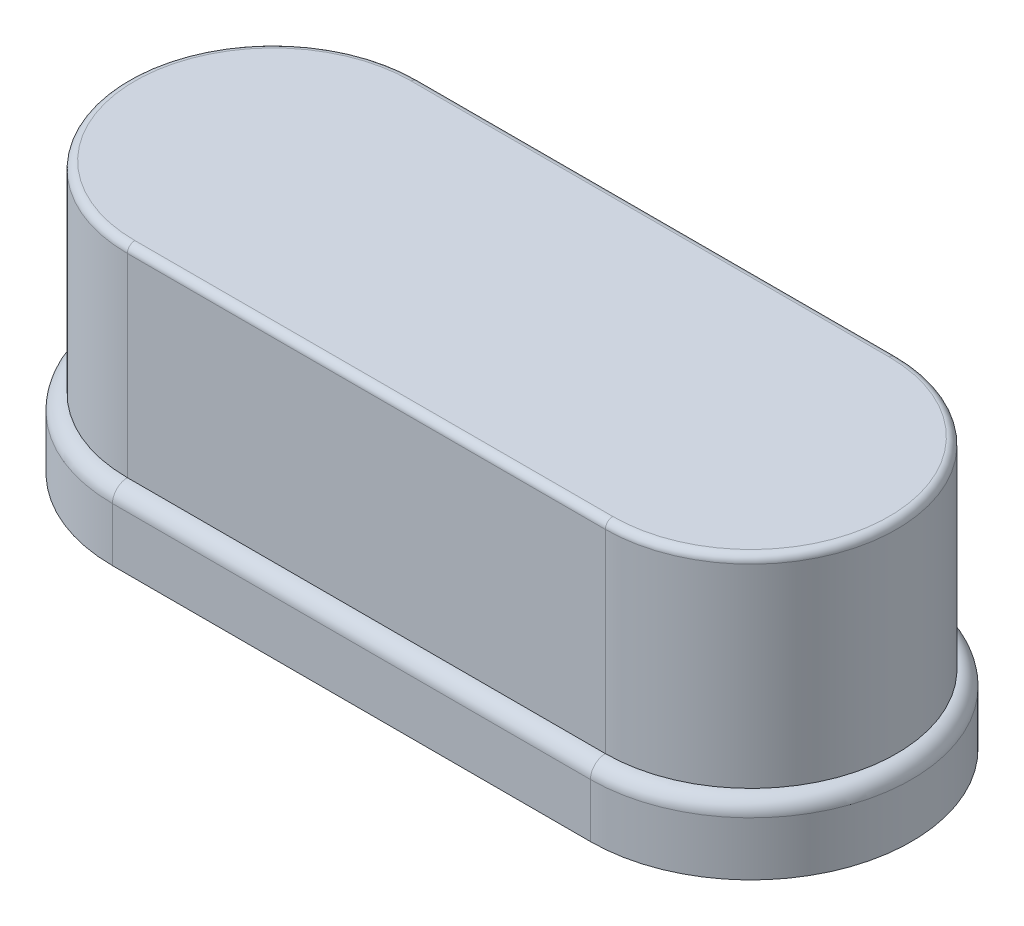
from build123d import *

# Parameters (mm, degrees)
BOSS_EXTRUDE1_DEPTH = 0.92
FILLET3_R           = 0.2
BOSS_EXTRUDE2_DEPTH = 2.7
FILLET4_R           = 0.1


with BuildPart() as part:
    # Sketch2 → Boss-Extrude1 (new body)
    with BuildSketch(Plane(origin=(0, 0, 0), x_dir=(1, 0, 0), z_dir=(0, 1, 0))):
        with BuildLine():
            Line((8.774632583, 14.872725815), (15.174632583, 14.872725815))
            ThreePointArc((15.174632583, 14.872725815), (17.324632583, 12.722725815), (15.174632583, 10.572725815))
            Line((15.174632583, 10.572725815), (8.774632583, 10.572725815))
            ThreePointArc((8.774632583, 10.572725815), (6.624632583, 12.722725815), (8.774632583, 14.872725815))
        make_face()
    extrude(amount=BOSS_EXTRUDE1_DEPTH)

    # Fillet3
    fillet3_edges = [part.edges().sort_by_distance(p)[0] for p in [
        (17.324632583, 0.92, -12.722725815),
        (11.974632583, 0.92, -14.872725815),
        (6.624632583, 0.92, -12.722725815),
        (11.974632583, 0.92, -10.572725815),
    ]]
    fillet(fillet3_edges, radius=FILLET3_R)

    # Sketch5 → Boss-Extrude2 (add)
    with BuildSketch(Plane(origin=(0, 0.92, 0), x_dir=(1, 0, 0), z_dir=(0, 1, 0))):
        with BuildLine():
            Line((8.774632583, 14.672725815), (15.174632583, 14.672725815))
            ThreePointArc((15.174632583, 14.672725815), (17.124632583, 12.722725815), (15.174632583, 10.772725815))
            Line((15.174632583, 10.772725815), (8.774632583, 10.772725815))
            ThreePointArc((8.774632583, 10.772725815), (6.824632583, 12.722725815), (8.774632583, 14.672725815))
        make_face()
    extrude(amount=BOSS_EXTRUDE2_DEPTH)

    # Fillet4
    fillet4_edges = [part.edges().sort_by_distance(p)[0] for p in [
        (6.824632583, 3.62, -12.722725815),
        (11.974632583, 3.62, -10.772725815),
        (17.124632583, 3.62, -12.722725815),
        (11.974632583, 3.62, -14.672725815),
    ]]
    fillet(fillet4_edges, radius=FILLET4_R)


solid = part.part
